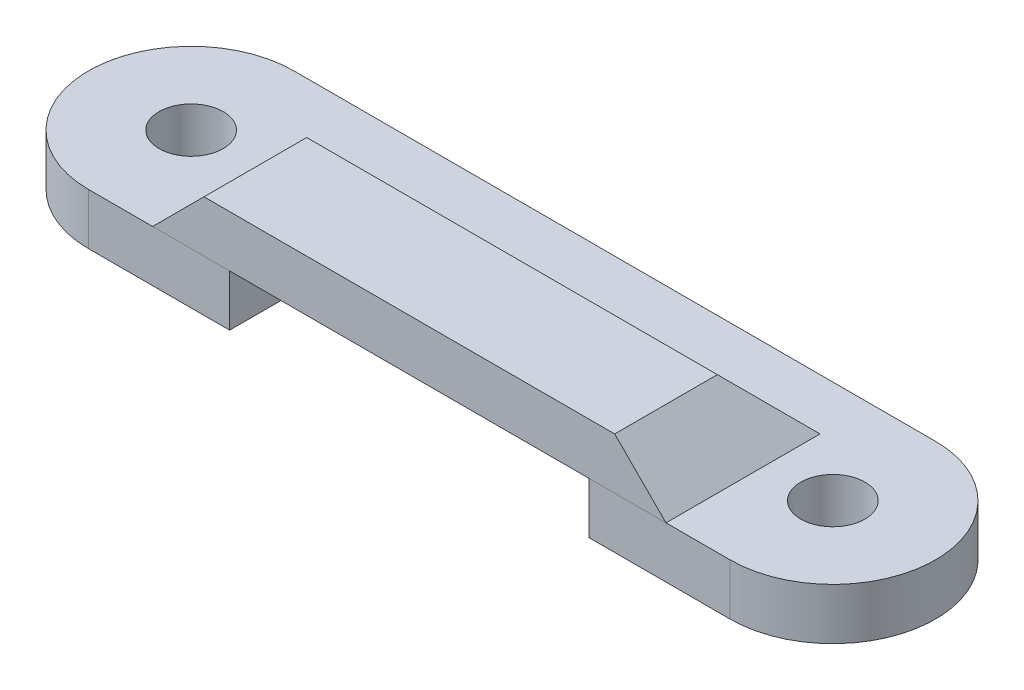
from build123d import *

# Parameters (mm, degrees)
SKETCH_1_R               = 2.5
EXTRUDE_1_DEPTH          = 4
EXTRUDE_2_DEPTH          = 12
SKETCH_3_W               = 28
SKETCH_3_H               = 4
CUT_EXTRUDE_1_DEPTH      = 8
CUT_EXTRUDE_2_DEPTH      = 36.20571672
CUT_EXTRUDE_2_DEPTH_BACK = 36.20571672


with BuildPart() as part:
    # 草图1 → 凸台-拉伸1 (new body)
    with BuildSketch(Plane(origin=(0, 0, 0), x_dir=(1, 0, 0), z_dir=(0, 1, 0))):
        with BuildLine():
            Line((-25, 9.297445336), (25, 9.297445336))
            ThreePointArc((25, 9.297445336), (33, 1.297445336), (25, -6.702554664))
            Line((25, -6.702554664), (-25, -6.702554664))
            ThreePointArc((-25, -6.702554664), (-33, 1.297445336), (-25, 9.297445336))
        make_face()
        with Locations(Location((-25, 1.297445336, 0), (0, 0, 270))):
            Circle(SKETCH_1_R, mode=Mode.SUBTRACT)
        with Locations(Location((25, 1.297445336, 0), (0, 0, 270))):
            Circle(SKETCH_1_R, mode=Mode.SUBTRACT)
    extrude(amount=EXTRUDE_1_DEPTH)

    # 草图3 → 切除-拉伸1 (cut)
    with BuildSketch(Plane.XY.offset(6.702554664)):
        with Locations((0, 2)):
            Rectangle(SKETCH_3_W, SKETCH_3_H)
    extrude(amount=-CUT_EXTRUDE_1_DEPTH, mode=Mode.SUBTRACT)


with BuildPart() as body_2:
    # 草图2 → 凸台-拉伸2 (new body)
    with BuildSketch(Plane.XY.offset(6.702554664)):
        Polygon((-20, 4), (-16, 8), (16, 8), (20, 4), align=None)
    extrude(amount=-EXTRUDE_2_DEPTH)

    # 草图4 → 切除-拉伸2 (cut, two sides: drawn at the far end of the back side and taken through both)
    with BuildSketch(Plane(origin=(0, 0, 0), x_dir=(0, 0, -1), z_dir=(1, 0, 0)).offset(-CUT_EXTRUDE_2_DEPTH_BACK)):
        Polygon((5.297445336, 8), (1.297445336, 8), (5.297445336, 4), align=None)
    extrude(amount=CUT_EXTRUDE_2_DEPTH + CUT_EXTRUDE_2_DEPTH_BACK, mode=Mode.SUBTRACT)


solid = Compound([part.part, body_2.part])
